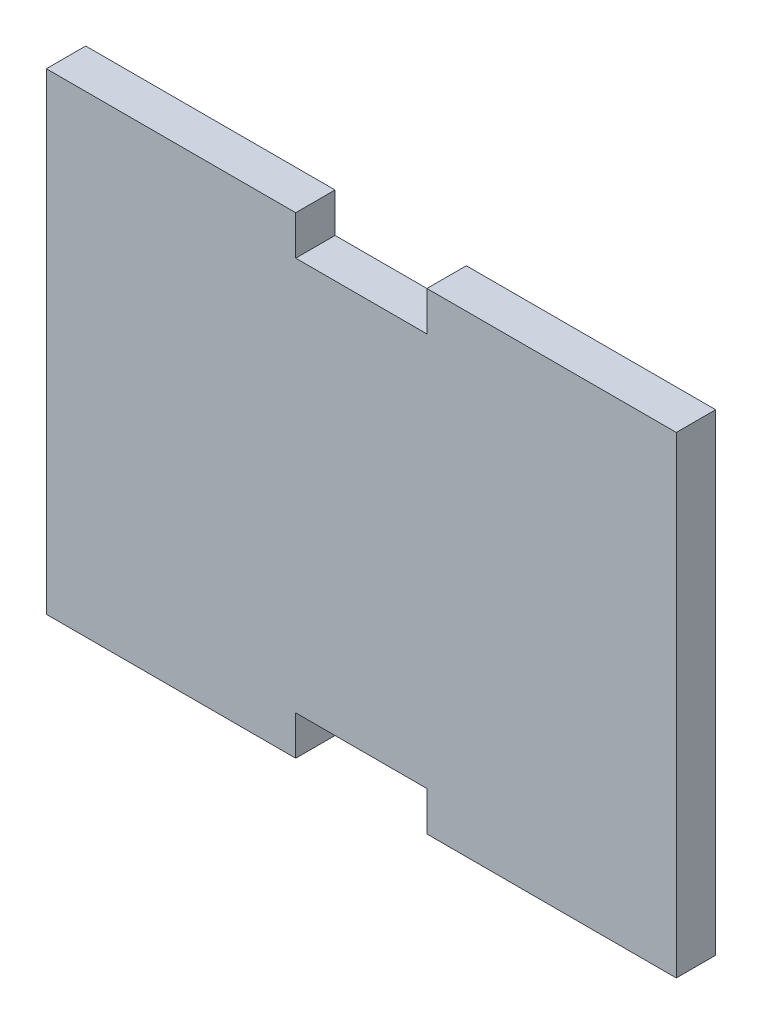
from build123d import *

# Parameters (mm, degrees)
BOSS_EXTRUDE1_DEPTH = 3


with BuildPart() as part:
    # Sketch1 → Boss-Extrude1 (new body)
    with BuildSketch(Plane.XY):
        Polygon((-23.627906977, 43.151162791), (-23.627906977, 40.151162791), (-13.627906977, 40.151162791), (-13.627906977, 43.151162791), (5.372093023, 43.151162791), (5.372093023, 7.151162791), (-13.627906977, 7.151162791), (-13.627906977, 10.151162791), (-23.627906977, 10.151162791), (-23.627906977, 7.151162791), (-42.627906977, 7.151162791), (-42.627906977, 43.151162791), align=None)
    extrude(amount=BOSS_EXTRUDE1_DEPTH)


solid = part.part
